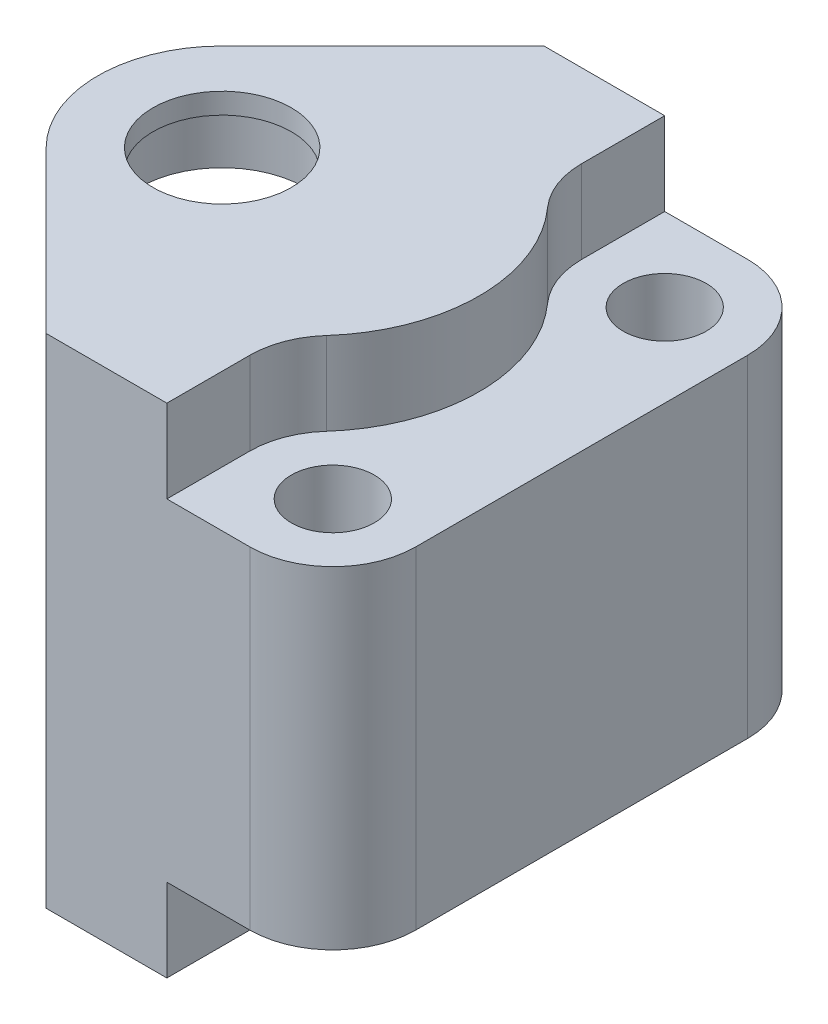
from build123d import *

# Parameters (mm, degrees)
SKETCH1_R           = 1.5
BOSS_EXTRUDE1_DEPTH = 9
CUT_EXTRUDE1_DEPTH  = 6.25
CUT_EXTRUDE2_START  = 9
CUT_EXTRUDE2_DEPTH  = 3
CUT_EXTRUDE3_START  = -6
CUT_EXTRUDE3_DEPTH  = 3


with BuildPart() as part:
    # Sketch1 → Boss-Extrude1 (new, symmetric)
    with BuildSketch(Plane(origin=(0, 0, 0), x_dir=(1, 0, 0), z_dir=(0, 1, 0))):
        with BuildLine():
            Line((13, 6), (13, -6))
            ThreePointArc((13, -6), (12.121320344, -8.121320344), (10, -9))
            Line((10, -9), (2.636038969, -9))
            Line((2.636038969, -9), (-3.181980515, -3.181980515))
            ThreePointArc((-3.181980515, -3.181980515), (-4.5, 0), (-3.181980515, 3.181980515))
            Line((-3.181980515, 3.181980515), (2.636038969, 9))
            Line((2.636038969, 9), (10, 9))
            ThreePointArc((10, 9), (12.121320344, 8.121320344), (13, 6))
        make_face()
        with Locations(Location((10, 6, 0), (0, 0, 270))):
            Circle(SKETCH1_R, mode=Mode.SUBTRACT)
        with Locations(Location((10, -6, 0), (0, 0, 270))):
            Circle(SKETCH1_R, mode=Mode.SUBTRACT)
    extrude(amount=BOSS_EXTRUDE1_DEPTH, both=True)

    # Sketch2 → Cut-Extrude1 (cut, symmetric)
    with BuildSketch(Plane(origin=(0, 0, 0), x_dir=(1, 0, 0), z_dir=(0, 1, 0))):
        with BuildLine():
            Line((5.000969408, 1.597749973), (2.636038969, 9))
            Line((2.636038969, 9), (-3.181980515, 3.181980515))
            ThreePointArc((-3.181980515, 3.181980515), (-4.5, 0), (-3.181980515, -3.181980515))
            Line((-3.181980515, -3.181980515), (2.636038969, -9))
            Line((2.636038969, -9), (5.000969408, -1.597749973))
            ThreePointArc((5.000969408, -1.597749973), (5.25, 0), (5.000969408, 1.597749973))
        make_face()
    extrude(amount=CUT_EXTRUDE1_DEPTH, both=True, mode=Mode.SUBTRACT)

    # Sketch3 → Cut-Revolve1 (revolve, cut)
    with BuildSketch(Plane.XY, mode=Mode.PRIVATE) as cut_revolve1_sk:
        Polygon((-2.5, 9), (-2.5, 8.25), (-3, 8.25), (-3, 6.25), (0, 6.25), (0, 9), align=None)
        Polygon((0, -6.25), (0, -9), (-2.5, -9), (-2.5, -8.25), (-3, -8.25), (-3, -6.25), align=None)
    revolve(cut_revolve1_sk.sketch.rotate(Axis((0, -11.503843925, 0), (0, 1, 0)), 270), axis=Axis((0, -11.503843925, 0), (0, 1, 0)), mode=Mode.SUBTRACT)

    # Sketch4 → Cut-Extrude2 (cut)
    with BuildSketch(Plane(origin=(0, 0, 0), x_dir=(1, 0, 0), z_dir=(0, 1, 0)).offset(CUT_EXTRUDE2_START)):
        with BuildLine():
            Line((7, -9), (10, -9))
            ThreePointArc((10, -9), (12.121320344, -8.121320344), (13, -6))
            Line((13, -6), (13, 6))
            ThreePointArc((13, 6), (12.121320344, 8.121320344), (10, 9))
            Line((10, 9), (7, 9))
            Line((7, 9), (7, 6))
            ThreePointArc((7, 6), (7.197482923, 4.929533731), (7.763932023, 4))
            ThreePointArc((7.763932023, 4), (9.291796068, 0), (7.763932023, -4))
            ThreePointArc((7.763932023, -4), (7.197482923, -4.929533731), (7, -6))
            Line((7, -6), (7, -9))
        make_face()
    extrude(amount=-CUT_EXTRUDE2_DEPTH, mode=Mode.SUBTRACT)

    # Sketch4<2> → Cut-Extrude3 (cut)
    with BuildSketch(Plane(origin=(0, 0, 0), x_dir=(1, 0, 0), z_dir=(0, 1, 0)).offset(CUT_EXTRUDE3_START)):
        with BuildLine():
            Line((7, -9), (10, -9))
            ThreePointArc((10, -9), (12.121320344, -8.121320344), (13, -6))
            Line((13, -6), (13, 6))
            ThreePointArc((13, 6), (12.121320344, 8.121320344), (10, 9))
            Line((10, 9), (7, 9))
            Line((7, 9), (7, 6))
            ThreePointArc((7, 6), (7.197482923, 4.929533731), (7.763932023, 4))
            ThreePointArc((7.763932023, 4), (9.291796068, 0), (7.763932023, -4))
            ThreePointArc((7.763932023, -4), (7.197482923, -4.929533731), (7, -6))
            Line((7, -6), (7, -9))
        make_face()
    extrude(amount=-CUT_EXTRUDE3_DEPTH, mode=Mode.SUBTRACT)


solid = part.part
